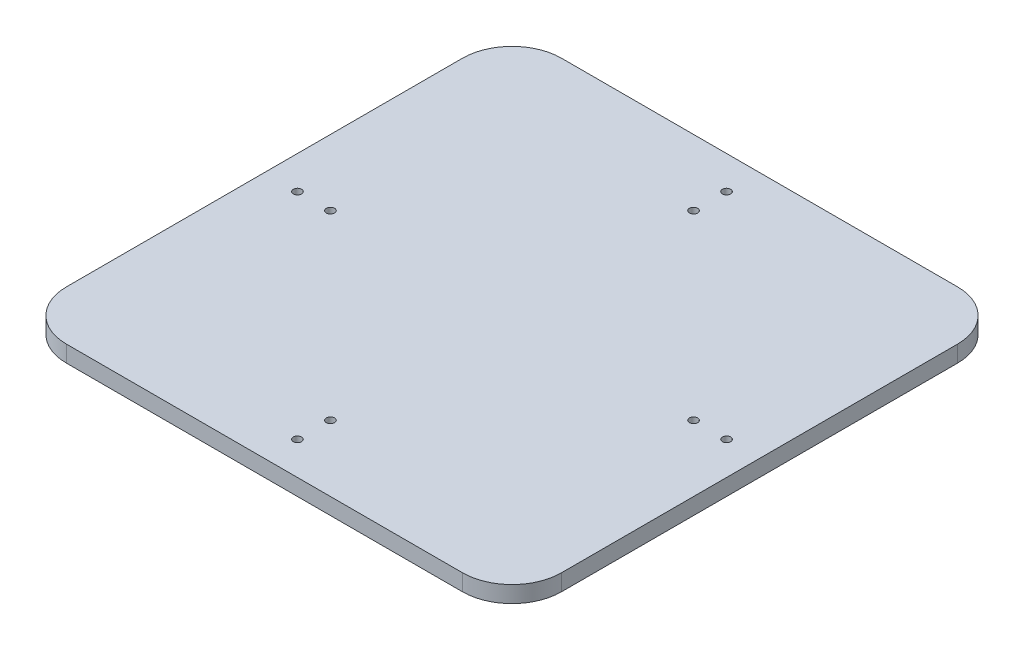
from build123d import *

# Parameters (mm, degrees)
BOSS_EXTRUDE3_DEPTH = 4
SKETCH2_R           = 2.5
BOSS_EXTRUDE4_DEPTH = 10
CUT_EXTRUDE1_DEPTH  = 52
SKETCH4_W           = 171.868784408
SKETCH4_H           = 181.506286336
BOSS_EXTRUDE5_DEPTH = 10


with BuildPart() as part:
    # Sketch1 → Boss-Extrude3 (new body)
    with BuildSketch(Plane(origin=(0, 0, 0), x_dir=(1, 0, 0), z_dir=(0, 1, 0))):
        with BuildLine():
            ThreePointArc((-75, -60), (-70.606601718, -70.606601718), (-60, -75))
            Line((-60, -75), (60, -75))
            ThreePointArc((60, -75), (70.606601718, -70.606601718), (75, -60))
            Line((75, -60), (75, 60))
            ThreePointArc((75, 60), (70.606601718, 70.606601718), (60, 75))
            Line((60, 75), (-60, 75))
            ThreePointArc((-60, 75), (-70.606601718, 70.606601718), (-75, 60))
            Line((-75, 60), (-75, -60))
        make_face()
    extrude(amount=BOSS_EXTRUDE3_DEPTH)

    # Sketch3 → Cut-Extrude1 (cut)
    with BuildSketch(Plane(origin=(0, 14, 0), x_dir=(1, 0, 0), z_dir=(0, 1, 0))):
        with BuildLine():
            Line((-60, 76), (60, 76))
            ThreePointArc((60, 76), (71.313708499, 71.313708499), (76, 60))
            Line((76, 60), (76, -60))
            ThreePointArc((76, -60), (71.313708499, -71.313708499), (60, -76))
            Line((60, -76), (-60, -76))
            ThreePointArc((-60, -76), (-71.313708499, -71.313708499), (-76, -60))
            Line((-76, -60), (-76, 60))
            ThreePointArc((-76, 60), (-71.313708499, 71.313708499), (-60, 76))
        make_face()
    extrude(amount=-CUT_EXTRUDE1_DEPTH, mode=Mode.SUBTRACT)


with BuildPart() as body_2:
    # Sketch2 → Boss-Extrude4 (new body)
    # profile 1 of 5: a face of its own
    with BuildSketch(Plane(origin=(0, 4, 0), x_dir=(1, 0, 0), z_dir=(0, 1, 0))):
        with BuildLine():
            ThreePointArc((150, -120), (141.213203436, -141.213203436), (120, -150))
            Line((120, -150), (-120, -150))
            ThreePointArc((-120, -150), (-141.213203436, -141.213203436), (-150, -120))
            Line((-150, -120), (-150, 120))
            ThreePointArc((-150, 120), (-141.213203436, 141.213203436), (-120, 150))
            Line((-120, 150), (120, 150))
            ThreePointArc((120, 150), (141.213203436, 141.213203436), (150, 120))
            Line((150, 120), (150, -120))
        make_face()
        with Locations(Location((-110, 0, 0), (0, 0, 270))):
            Circle(SKETCH2_R, mode=Mode.SUBTRACT)
        with Locations(Location((-130, 0, 0), (0, 0, 270))):
            Circle(SKETCH2_R, mode=Mode.SUBTRACT)
        with Locations(Location((130, 0, 0), (0, 0, 270))):
            Circle(SKETCH2_R, mode=Mode.SUBTRACT)
        with Locations(Location((110, 0, 0), (0, 0, 270))):
            Circle(SKETCH2_R, mode=Mode.SUBTRACT)
        with Locations(Location((0, -130, 0), (0, 0, 270))):
            Circle(SKETCH2_R, mode=Mode.SUBTRACT)
        with Locations(Location((0, -110, 0), (0, 0, 270))):
            Circle(SKETCH2_R, mode=Mode.SUBTRACT)
        with Locations(Location((0, 110, 0), (0, 0, 270))):
            Circle(SKETCH2_R, mode=Mode.SUBTRACT)
        with Locations(Location((0, 130, 0), (0, 0, 270))):
            Circle(SKETCH2_R, mode=Mode.SUBTRACT)
        Polygon((-76, -76), (-76, 76), (0, 76), (76, 76), (76, -76), align=None, mode=Mode.SUBTRACT)
    # profile 2 of 5: a face of its own
    with BuildSketch(Plane(origin=(0, 4, 0), x_dir=(1, 0, 0), z_dir=(0, 1, 0))):
        with BuildLine():
            ThreePointArc((-60, -76), (-71.313708499, -71.313708499), (-76, -60))
            Line((-76, -60), (-76, -76))
            Line((-76, -76), (-60, -76))
        make_face()
    # profile 3 of 5: a face of its own
    with BuildSketch(Plane(origin=(0, 4, 0), x_dir=(1, 0, 0), z_dir=(0, 1, 0))):
        with BuildLine():
            Line((76, -76), (76, -60))
            ThreePointArc((76, -60), (71.313708499, -71.313708499), (60, -76))
            Line((60, -76), (76, -76))
        make_face()
    # profile 4 of 5: a face of its own
    with BuildSketch(Plane(origin=(0, 4, 0), x_dir=(1, 0, 0), z_dir=(0, 1, 0))):
        with BuildLine():
            Line((76, 76), (60, 76))
            ThreePointArc((60, 76), (71.313708499, 71.313708499), (76, 60))
            Line((76, 60), (76, 76))
        make_face()
    # profile 5 of 5: a face of its own
    with BuildSketch(Plane(origin=(0, 4, 0), x_dir=(1, 0, 0), z_dir=(0, 1, 0))):
        with BuildLine():
            ThreePointArc((-76, 60), (-71.313708499, 71.313708499), (-60, 76))
            Line((-60, 76), (-76, 76))
            Line((-76, 76), (-76, 60))
        make_face()
    extrude(amount=BOSS_EXTRUDE4_DEPTH)

    # Sketch4 → Boss-Extrude5 (add)
    with BuildSketch(Plane(origin=(0, 14, 0), x_dir=(1, 0, 0), z_dir=(0, 1, 0))):
        Rectangle(SKETCH4_W, SKETCH4_H)
    extrude(amount=-BOSS_EXTRUDE5_DEPTH)


solid = body_2.part
